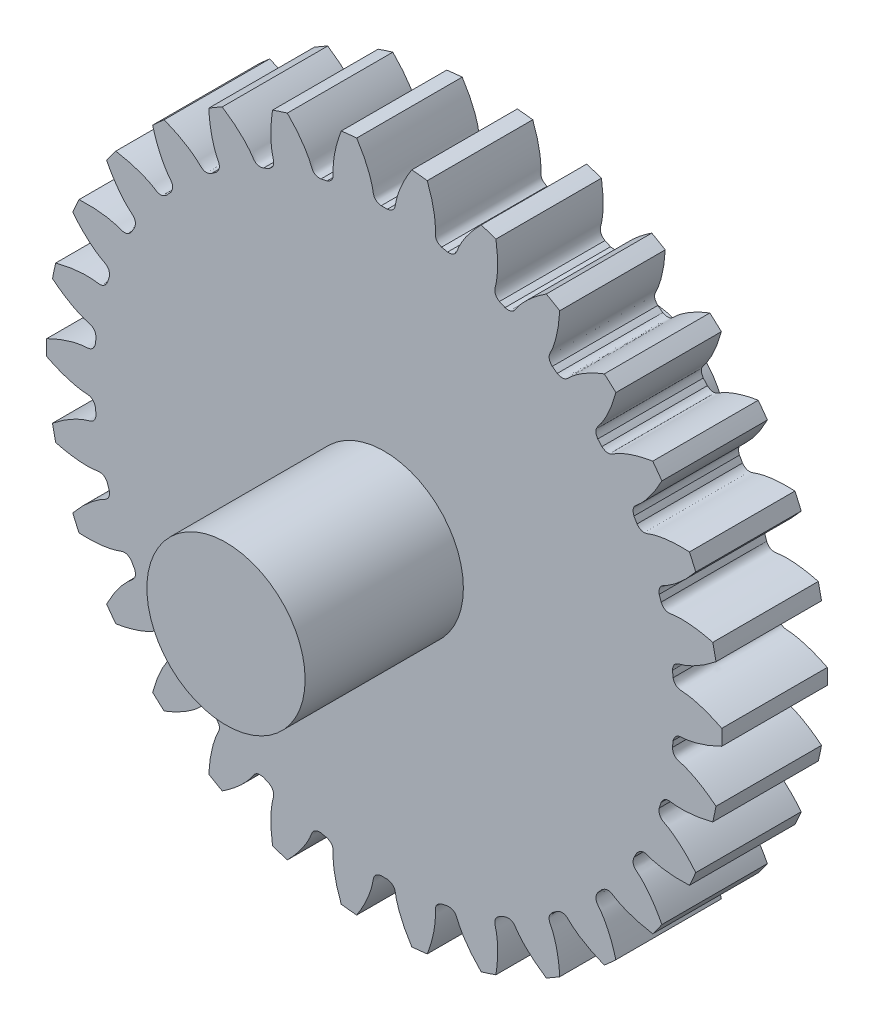
from build123d import *

# Parameters (mm, degrees)
SKETCH_1_R               = 32
EXTRUDE_1_DEPTH          = 10
CUT_EXTRUDE_1_DEPTH      = 47.346520905
PATTERN_CIRCULAR_1_COUNT = 30
SKETCH_4_R               = 7.5
EXTRUDE_2_DEPTH          = 15
EXTRUDE_START            = 15
SKETCH_5_R               = 7.5
EXTRUDE_3_DEPTH          = 15


with BuildPart() as part:
    # 草图1 → 凸台-拉伸1 (new body)
    with BuildSketch(Plane.XY):
        Circle(SKETCH_1_R)
    extrude(amount=EXTRUDE_1_DEPTH)

    # 草图2 → 切除-拉伸1 (cut, through all)
    with BuildSketch(Plane.XY):
        with BuildLine():
            ThreePointArc((0.291117258, 27.498459061), (0, 27.5), (-0.291117258, 27.498459061))
            add(Edge.make_bspline(
                [(-0.291117258, 27.498459061), (-1.016461379, 27.62595034), (-1.020609493, 28.094265272), (-1.11796964, 28.57715803), (-1.139901483, 28.676258475), (-1.166494173, 28.785849819), (-1.198135434, 28.905795984), (-1.235261247, 29.035929815), (-1.278286716, 29.176077028), (-1.327627025, 29.326048954), (-1.383690587, 29.485644922), (-1.446880683, 29.65465171), (-1.517594534, 29.8328439), (-1.596223153, 30.019983966), (-1.683150964, 30.215822454), (-1.778755503, 30.42009815), (-1.883407094, 30.632538255), (-1.99746854, 30.852858572), (-2.121294814, 31.0807637), (-2.255232758, 31.315947232), (-2.399620786, 31.558091968), (-2.554788592, 31.806870128), (-2.721056861, 32.061943577), (-2.89873699, 32.322964055), (-3.088130814, 32.589573415), (-3.289530328, 32.861403867), (-3.503217435, 33.138078232), (-3.729463678, 33.419210196), (-3.968529992, 33.70440458), (-4.220666464, 33.993257607), (-4.486112085, 34.285357181), (-4.765094529, 34.580283169), (-5.057829915, 34.877607694), (-5.364522622, 35.176895427), (-5.685364966, 35.47770389), (-6.137847732, 35.885241657), (-6.490689237, 36.184143062), (-6.732623663, 36.381116246)],
                knots=[0, 0, 0, 0, 0.115323882, 0.12341257, 0.132512303, 0.142623081, 0.153744905, 0.165877774, 0.179021689, 0.193176649, 0.208342655, 0.224519706, 0.241707802, 0.259906945, 0.279117132, 0.299338365, 0.320570644, 0.342813968, 0.366068337, 0.390333752, 0.415610213, 0.441897719, 0.46919627, 0.497505867, 0.52682651, 0.557158198, 0.588500931, 0.62085471, 0.654219534, 0.688595404, 0.723982319, 0.76038028, 0.797789286, 0.836209338, 0.875640435, 0.916082578, 1, 1, 1, 1], degree=3))
            ThreePointArc((-6.732623663, 36.381116246), (0, 36.998835667), (6.732623663, 36.381116246))
            add(Edge.make_bspline(
                [(0.291117258, 27.498459061), (1.016461379, 27.62595034), (1.020609493, 28.094265272), (1.11796964, 28.57715803), (1.139901483, 28.676258475), (1.166494173, 28.785849819), (1.198135434, 28.905795984), (1.235261247, 29.035929815), (1.278286716, 29.176077028), (1.327627025, 29.326048954), (1.383690587, 29.485644922), (1.446880683, 29.65465171), (1.517594534, 29.8328439), (1.596223153, 30.019983966), (1.683150964, 30.215822454), (1.778755503, 30.42009815), (1.883407094, 30.632538255), (1.99746854, 30.852858572), (2.121294814, 31.0807637), (2.255232758, 31.315947232), (2.399620786, 31.558091968), (2.554788592, 31.806870128), (2.721056861, 32.061943577), (2.89873699, 32.322964055), (3.088130814, 32.589573415), (3.289530328, 32.861403867), (3.503217435, 33.138078232), (3.729463678, 33.419210196), (3.968529992, 33.70440458), (4.220666464, 33.993257607), (4.486112085, 34.285357181), (4.765094529, 34.580283169), (5.057829915, 34.877607694), (5.364522622, 35.176895427), (5.685364966, 35.47770389), (6.137847732, 35.885241657), (6.490689237, 36.184143062), (6.732623663, 36.381116246)],
                knots=[0, 0, 0, 0, 0.115323882, 0.12341257, 0.132512303, 0.142623081, 0.153744905, 0.165877774, 0.179021689, 0.193176649, 0.208342655, 0.224519706, 0.241707802, 0.259906945, 0.279117132, 0.299338365, 0.320570644, 0.342813968, 0.366068337, 0.390333752, 0.415610213, 0.441897719, 0.46919627, 0.497505867, 0.52682651, 0.557158198, 0.588500931, 0.62085471, 0.654219534, 0.688595404, 0.723982319, 0.76038028, 0.797789286, 0.836209338, 0.875640435, 0.916082578, 1, 1, 1, 1], degree=3))
        make_face()
    cut_extrude_1 = extrude(amount=CUT_EXTRUDE_1_DEPTH, mode=Mode.SUBTRACT)

    # 阵列(圆周)1: 切除-拉伸1 ×30 about axis
    pattern_circular_1_axis = Axis((0, 0, 10), (0, 0, -1))
    for i in range(1, PATTERN_CIRCULAR_1_COUNT):
        add(cut_extrude_1.rotate(pattern_circular_1_axis, i * 360 / PATTERN_CIRCULAR_1_COUNT), mode=Mode.SUBTRACT)

    # 草图4 → 凸台-拉伸2 (add)
    with BuildSketch(Plane.XY.offset(10)):
        Circle(SKETCH_4_R)
    extrude(amount=EXTRUDE_2_DEPTH)

    # 草图5 → 凸台-拉伸3 (add)
    with BuildSketch(Plane(origin=(0, 0, 0), x_dir=(-1, 0, 0), z_dir=(0, 0, -1)).offset(EXTRUDE_START)):
        Circle(SKETCH_5_R)
    extrude(amount=-EXTRUDE_3_DEPTH)


solid = part.part
